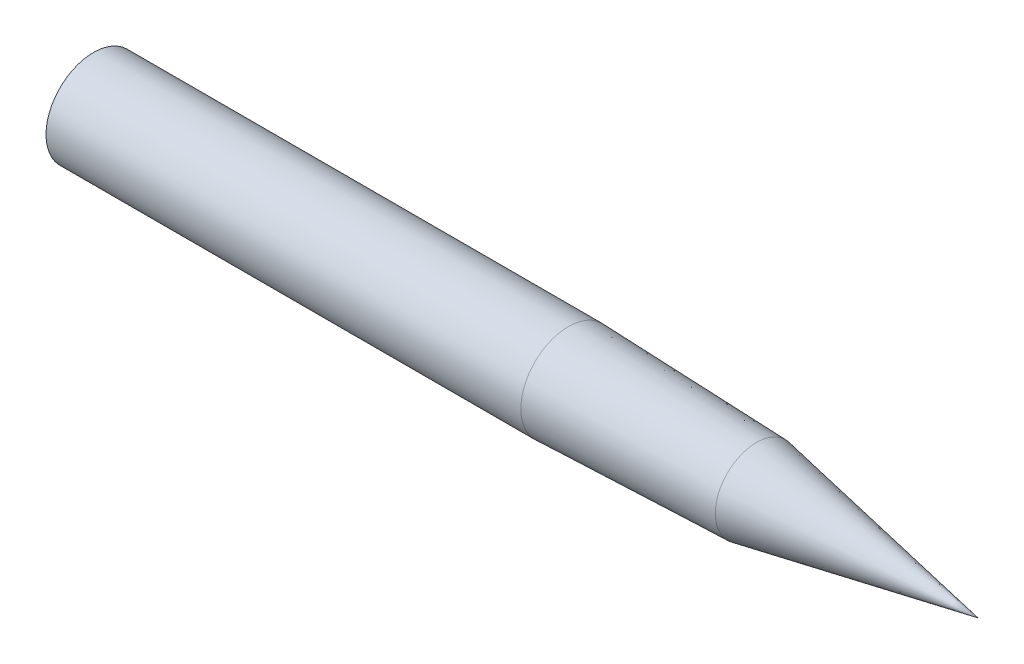
from build123d import *


with BuildPart() as part:
    # Sketch1 → Revolve1 (revolve)
    with BuildSketch(Plane.XY, mode=Mode.PRIVATE) as revolve1_sk:
        Polygon((0, 0), (27.939118754, 0), (20.939118754, 1.3), (15, 1.5), (0, 1.5), align=None)
    revolve(revolve1_sk.sketch.rotate(Axis((0, 0, 0), (1, 0, 0)), 90), axis=Axis((0, 0, 0), (1, 0, 0)))


solid = part.part
